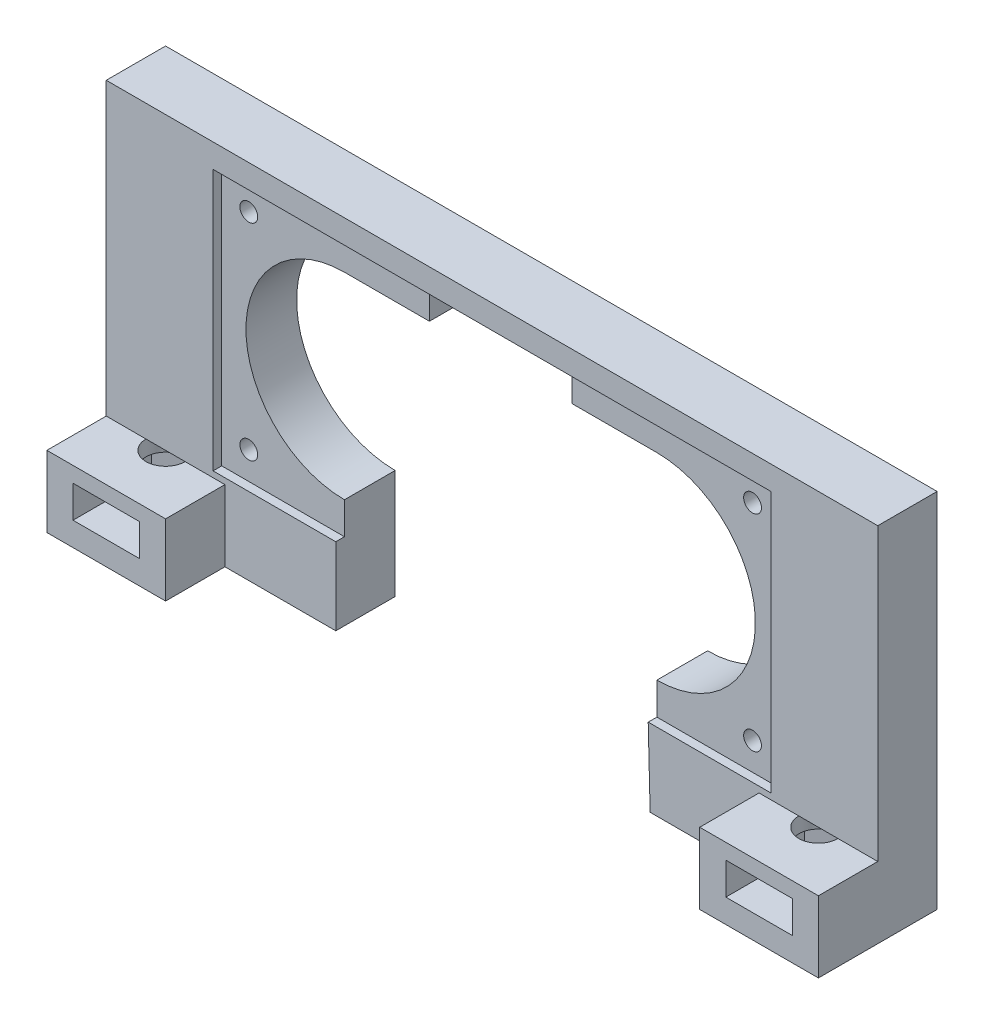
from build123d import *

# Parameters (mm, degrees)
EXTRUDE_1_DEPTH      = 5
SKETCH_1_R           = 0.75
CUT_EXTRUDE_11_DEPTH = 5
SKETCH_3_W           = 47
SKETCH_3_H           = 22
CUT_EXTRUDE_14_DEPTH = 0.73
SKETCH_4_W           = 10
SKETCH_4_H           = 10
EXTRUDE_2_DEPTH      = 6
SKETCH_5_R           = 1.65
CUT_EXTRUDE_15_DEPTH = 6
CUT_EXTRUDE_16_DEPTH = 2.7
CUT_EXTRUDE_17_DEPTH = 2


with BuildPart() as part:
    # Эскиз2 → Бобышка-Вытянуть1 (new body)
    with BuildSketch(Plane.XY):
        Polygon((-32.499999999, 13), (32.500000001, 13), (32.500000001, -17.5), (13.323102298, -17.5), (13.16, -11), (-13.16, -11), (-13.16, -17.5), (-32.499999999, -17.5), align=None)
    extrude(amount=EXTRUDE_1_DEPTH)

    # Эскиз1 → Вырез-Вытянуть11 (cut)
    with BuildSketch(Plane.XY):
        with Locations((21.22, 8.675)):
            Circle(SKETCH_1_R)
        with Locations(Location((21.22, -8.675, 0), (0, 0, 180))):
            Circle(SKETCH_1_R)
        with Locations((-21.22, -8.675)):
            Circle(SKETCH_1_R)
        with Locations(Location((-21.22, 8.675, 0), (0, 0, 180))):
            Circle(SKETCH_1_R)
        with BuildLine():
            Line((13.16, 8.3), (6, 8.3))
            Line((6, 8.3), (6, 11))
            Line((6, 11), (-6, 11))
            Line((-6, 11), (-6, 8.3))
            Line((-6, 8.3), (-13.16, 8.3))
            ThreePointArc((-13.16, 8.3), (-21.46, 0), (-13.16, -8.3))
            Line((-13.16, -8.3), (-13.16, -11))
            Line((-13.16, -11), (13.16, -11))
            Line((13.16, -11), (13.16, -8.3))
            ThreePointArc((13.16, -8.3), (21.46, 0), (13.16, 8.3))
        make_face()
    extrude(amount=CUT_EXTRUDE_11_DEPTH, mode=Mode.SUBTRACT)

    # Эскиз3 → Вырез-Вытянуть14 (cut)
    with BuildSketch(Plane.XY.offset(5)):
        Rectangle(SKETCH_3_W, SKETCH_3_H)
    extrude(amount=-CUT_EXTRUDE_14_DEPTH, mode=Mode.SUBTRACT)

    # Эскиз4 → Бобышка-Вытянуть2 (add)
    with BuildSketch(Plane.XZ.offset(17.5)):
        with Locations((-27.499999999, 5)):
            Rectangle(SKETCH_4_W, SKETCH_4_H)
        with Locations((27.500000001, 5)):
            Rectangle(SKETCH_4_W, SKETCH_4_H)
    extrude(amount=-EXTRUDE_2_DEPTH)

    # Эскиз5 → Вырез-Вытянуть15 (cut)
    with BuildSketch(Plane.XZ.offset(17.5)):
        with Locations((-27.499999999, 5)):
            Circle(SKETCH_5_R)
        with Locations((27.500000001, 5)):
            Circle(SKETCH_5_R)
    extrude(amount=-CUT_EXTRUDE_15_DEPTH, mode=Mode.SUBTRACT)

    # Эскиз6 → Вырез-Вытянуть16 (cut)
    with BuildSketch(Plane(origin=(0, -15.5, 0), x_dir=(-1, 0, 0), z_dir=(0, -1, 0))):
        Polygon((30.299999999, -6.616580754), (30.299999999, -10), (24.699999999, -10), (24.699999999, -6.616580754), (24.699999999, -3.383419246), (27.499999999, -1.766838493), (30.299999999, -3.383419246), align=None)
        Polygon((-24.700000001, -6.616580754), (-24.700000001, -10), (-30.300000001, -10), (-30.300000001, -6.616580754), (-30.300000001, -3.383419246), (-27.500000001, -1.766838493), (-24.700000001, -3.383419246), align=None)
    extrude(amount=-CUT_EXTRUDE_16_DEPTH, mode=Mode.SUBTRACT)

    # Эскиз7 → Вырез-Вытянуть17 (cut)
    with BuildSketch(Plane(origin=(0, 0, 0), x_dir=(-1, 0, 0), z_dir=(0, 0, -1))):
        Polygon((-21.22, 10.522520861), (-22.82, 9.598760431), (-22.82, 7.751239569), (-21.22, 6.827479139), (-19.62, 7.751239569), (-19.62, 9.598760431), align=None)
        Polygon((-21.22, -6.827479139), (-22.82, -7.751239569), (-22.82, -9.598760431), (-21.22, -10.522520861), (-19.62, -9.598760431), (-19.62, -7.751239569), align=None)
        Polygon((21.22, 10.522520861), (19.62, 9.598760431), (19.62, 7.751239569), (21.22, 6.827479139), (22.82, 7.751239569), (22.82, 9.598760431), align=None)
        Polygon((21.22, -6.827479139), (19.62, -7.751239569), (19.62, -9.598760431), (21.22, -10.522520861), (22.82, -9.598760431), (22.82, -7.751239569), align=None)
    extrude(amount=-CUT_EXTRUDE_17_DEPTH, mode=Mode.SUBTRACT)


solid = part.part
